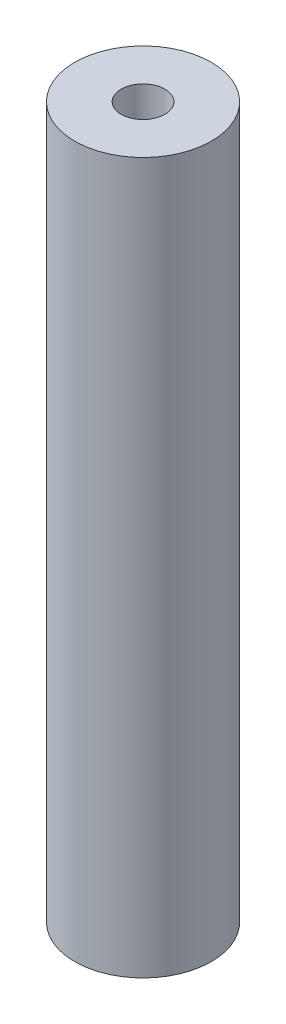
from build123d import *

# Parameters (mm, degrees)
SKETCH1_R                           = 2.5
BOSS_EXTRUDE1_DEPTH                 = 13
M2X0_4_TAPPED_HOLE1_D               = 1.6
M2X0_4_TAPPED_HOLE1_DEPTH           = 5.2
M2X0_4_TAPPED_HOLE1_TIP             = 0.480688495
M2X0_4_TAPPED_HOLE1_ON_FACE_2_D     = 1.6
M2X0_4_TAPPED_HOLE1_ON_FACE_2_DEPTH = 5.2
M2X0_4_TAPPED_HOLE1_ON_FACE_2_TIP   = 0.480688495


with BuildPart() as part:
    # Sketch1 → Boss-Extrude1 (new, symmetric)
    with BuildSketch(Plane(origin=(0, 0, 0), x_dir=(1, 0, 0), z_dir=(0, 1, 0))):
        Circle(SKETCH1_R)
    extrude(amount=BOSS_EXTRUDE1_DEPTH, both=True)

    # M2x0.4 Tapped Hole1
    with Locations(Plane.ZX.offset(13)):
        with Locations((0, 0)):
            Hole(M2X0_4_TAPPED_HOLE1_D / 2, depth=M2X0_4_TAPPED_HOLE1_DEPTH)
            with Locations((0, 0, -(M2X0_4_TAPPED_HOLE1_DEPTH + M2X0_4_TAPPED_HOLE1_TIP / 2))):  # 118° drill point
                Cone(0, M2X0_4_TAPPED_HOLE1_D / 2, M2X0_4_TAPPED_HOLE1_TIP, mode=Mode.SUBTRACT)

    # M2x0.4 Tapped Hole1 on face 2
    with Locations(Plane(origin=(0, -13, 0), x_dir=(0, 0, -1), z_dir=(0, -1, 0))):
        with Locations((0, 0)):
            Hole(M2X0_4_TAPPED_HOLE1_ON_FACE_2_D / 2, depth=M2X0_4_TAPPED_HOLE1_ON_FACE_2_DEPTH)
            with Locations((0, 0, -(M2X0_4_TAPPED_HOLE1_ON_FACE_2_DEPTH + M2X0_4_TAPPED_HOLE1_ON_FACE_2_TIP / 2))):  # 118° drill point
                Cone(0, M2X0_4_TAPPED_HOLE1_ON_FACE_2_D / 2, M2X0_4_TAPPED_HOLE1_ON_FACE_2_TIP, mode=Mode.SUBTRACT)


solid = part.part
